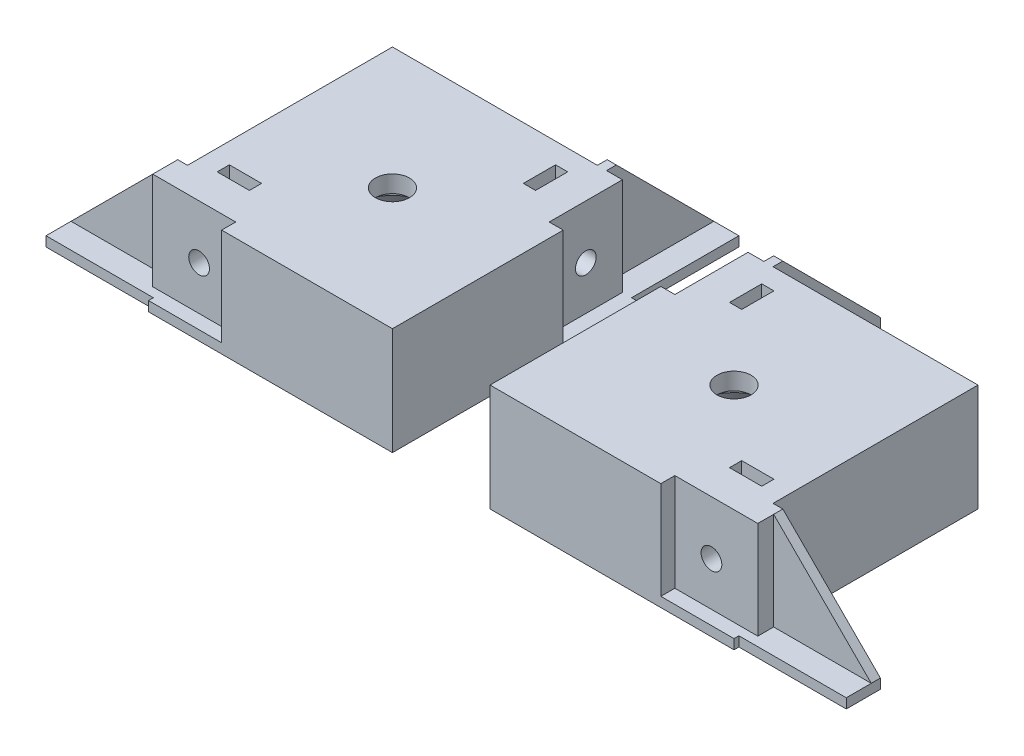
from build123d import *

# Parameters (mm, degrees)
BOSS_EXTRUDE1_DEPTH      = 11
BOSS_EXTRUDE1_DEPTH_BACK = 11
SKETCH1_W                = 50
SKETCH1_H                = 50
BOSS_EXTRUDE2_DEPTH      = 22
CUT_EXTRUDE1_DEPTH       = 7
SKETCH5_W                = 2
SKETCH5_H                = 3.25
BOSS_EXTRUDE3_DEPTH      = 20
SKETCH6_W                = 37
SKETCH6_H                = 2.875
CUT_EXTRUDE2_DEPTH       = 20
SKETCH8_R                = 2.125
CUT_EXTRUDE3_DEPTH       = 6
SKETCH9_W                = 6.6
SKETCH9_H                = 2.5
CUT_EXTRUDE4_DEPTH       = 14.4
SKETCH11_R               = 2
CUT_EXTRUDE5_DEPTH       = 8


with BuildPart() as part:
    # Sketch1 → Boss-Extrude1 (new, two sides: drawn at the far end of the back side and taken through both)
    with BuildSketch(Plane(origin=(0, 0, 0), x_dir=(1, 0, 0), z_dir=(0, 1, 0)).offset(-BOSS_EXTRUDE1_DEPTH_BACK)):
        Rectangle(SKETCH1_W, SKETCH1_H)
    extrude(amount=BOSS_EXTRUDE1_DEPTH + BOSS_EXTRUDE1_DEPTH_BACK)

    # Sketch2 → Cut-Revolve1 (revolve, cut)
    with BuildSketch(Plane.XY):
        Polygon((-3.5, 7.5), (-3.5, 11), (0, 11), (0, -11), (-18, -11), (-10.5, 4), (-8, 4), (-8, 7.5), align=None)
    revolve(axis=Axis((0, 11, 0), (0, -1, 0)), mode=Mode.SUBTRACT)

    # Sketch3 → Boss-Extrude2 (add)
    with BuildSketch(Plane(origin=(25, 0, 0), x_dir=(0, 0, -1), z_dir=(1, 0, 0))):
        Polygon((-24, 11), (-22.125, 11), (-22.125, -9), (-18.875, -9), (-18.875, 11), (-17, 11), (-17, -11), (-24, -11), align=None)
    boss_extrude2 = extrude(amount=BOSS_EXTRUDE2_DEPTH)

    # Sketch4 → Cut-Extrude1 (cut)
    with BuildSketch(Plane(origin=(0, 0, 17), x_dir=(-1, 0, 0), z_dir=(0, 0, -1))):
        Polygon((-47, -9), (-27, 11), (-47, 11), align=None)
    cut_extrude1 = extrude(amount=-CUT_EXTRUDE1_DEPTH, mode=Mode.SUBTRACT)

    # Sketch5 → Boss-Extrude3 (add)
    with BuildSketch(Plane(origin=(0, -9, 0), x_dir=(1, 0, 0), z_dir=(0, 1, 0))):
        with Locations((26, -20.5)):
            Rectangle(SKETCH5_W, SKETCH5_H)
    extrude(amount=BOSS_EXTRUDE3_DEPTH)

    # Sketch6 → Cut-Extrude2 (cut)
    with BuildSketch(Plane(origin=(0, 11, 0), x_dir=(1, 0, 0), z_dir=(0, 1, 0))):
        with Locations((28.5, -23.5625)):
            Rectangle(SKETCH6_W, SKETCH6_H)
    cut_extrude2 = extrude(amount=-CUT_EXTRUDE2_DEPTH, mode=Mode.SUBTRACT)

    # Sketch8 → Cut-Extrude3 (cut)
    with BuildSketch(Plane.XY.offset(22.125)):
        with Locations((17.5, 0)):
            Circle(SKETCH8_R)
    cut_extrude3 = extrude(amount=-CUT_EXTRUDE3_DEPTH, mode=Mode.SUBTRACT)

    # Sketch9 → Cut-Extrude4 (cut)
    with BuildSketch(Plane(origin=(0, 11, 0), x_dir=(1, 0, 0), z_dir=(0, 1, 0))):
        with Locations((17.5, -13.875)):
            Rectangle(SKETCH9_W, SKETCH9_H)
    cut_extrude4 = extrude(amount=-CUT_EXTRUDE4_DEPTH, mode=Mode.SUBTRACT)

    # Sketch11 → Cut-Extrude5 (cut)
    with BuildSketch(Plane.XY.offset(16.125)):
        with Locations((17.5, 0)):
            Circle(SKETCH11_R)
    cut_extrude5 = extrude(amount=-CUT_EXTRUDE5_DEPTH, mode=Mode.SUBTRACT)

    # Mirror1: Boss-Extrude2, Cut-Extrude1, Cut-Extrude2, Cut-Extrude3, Cut-Extrude4, Cut-Extrude5 across plane
    add(boss_extrude2.mirror(Plane(origin=(0, 0, 0), x_dir=(-0.7071067811865476, 0, 0.7071067811865476), z_dir=(0.7071067811865477, 0, 0.7071067811865475))))
    add(cut_extrude1.mirror(Plane(origin=(0, 0, 0), x_dir=(-0.7071067811865476, 0, 0.7071067811865476), z_dir=(0.7071067811865477, 0, 0.7071067811865475))), mode=Mode.SUBTRACT)
    add(cut_extrude2.mirror(Plane(origin=(0, 0, 0), x_dir=(-0.7071067811865476, 0, 0.7071067811865476), z_dir=(0.7071067811865477, 0, 0.7071067811865475))), mode=Mode.SUBTRACT)
    add(cut_extrude3.mirror(Plane(origin=(0, 0, 0), x_dir=(-0.7071067811865476, 0, 0.7071067811865476), z_dir=(0.7071067811865477, 0, 0.7071067811865475))), mode=Mode.SUBTRACT)
    add(cut_extrude4.mirror(Plane(origin=(0, 0, 0), x_dir=(-0.7071067811865476, 0, 0.7071067811865476), z_dir=(0.7071067811865477, 0, 0.7071067811865475))), mode=Mode.SUBTRACT)
    add(cut_extrude5.mirror(Plane(origin=(0, 0, 0), x_dir=(-0.7071067811865476, 0, 0.7071067811865476), z_dir=(0.7071067811865477, 0, 0.7071067811865475))), mode=Mode.SUBTRACT)


with BuildPart() as body_2:
    # Mirror2: mirrored copy
    add(part.part.mirror(Plane.ZY.offset(35)))


solid = Compound([part.part, body_2.part])
